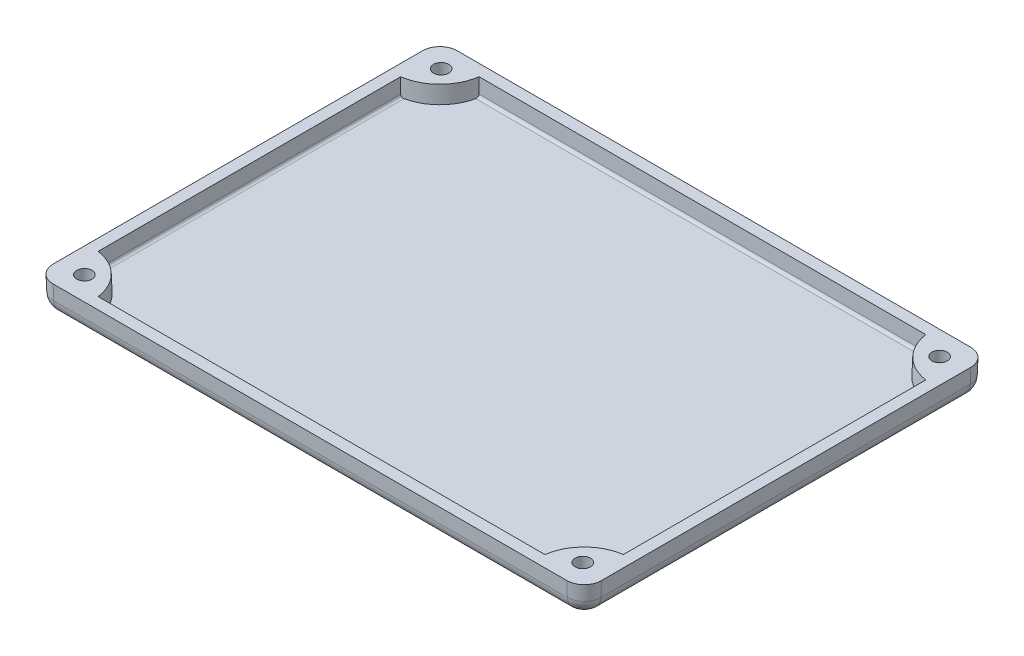
from build123d import *

# Parameters (mm, degrees)
BOSS_EXTRUDE1_MAINBOX_DEPTH             = 5
BOSS_EXTRUDE1_MAINBOX_TAPER             = 2
FILLET1_R                               = 2.5
SHELL1_T                                = -2
BOSS_EXTRUDE2_CORNERS_REACH             = 61.214
BOSS_EXTRUDE2_CORNERS_DRAFT             = 2
SKETCH3_R                               = 1.5
CUT_EXTRUDE1_SCREWHOLES_DEPTH           = 10
CUT_EXTRUDE1_SCREWHOLES_DRAFT           = -2
CUT_EXTRUDE1_SCREWHOLES_PROFILE_2_DEPTH = 10
CUT_EXTRUDE1_SCREWHOLES_PROFILE_2_DRAFT = -2
CUT_EXTRUDE1_SCREWHOLES_PROFILE_3_DEPTH = 10
CUT_EXTRUDE1_SCREWHOLES_PROFILE_3_DRAFT = -2
CUT_EXTRUDE1_SCREWHOLES_PROFILE_4_DEPTH = 10
CUT_EXTRUDE1_SCREWHOLES_PROFILE_4_DRAFT = -2


with BuildPart() as part:
    # Sketch1 → Boss-Extrude1-MainBox (new body)
    with BuildSketch(Plane(origin=(0, 0, 0), x_dir=(-1, 0, 0), z_dir=(0, -1, 0))):
        with BuildLine():
            add(Edge.make_bspline(
                [(47.5, -32.001827519), (47.5, -35), (44.501827519, -35)],
                knots=[5.498396131, 5.498396131, 5.498396131, 7.067974483, 7.067974483, 7.067974483], degree=2, weights=[1, 0.707537269, 1]))
            Line((47.5, -32.001827519), (47.5, 32.001827519))
            add(Edge.make_bspline(
                [(44.501827519, 35), (47.5, 35), (47.5, 32.001827519)],
                knots=[5.498396131, 5.498396131, 5.498396131, 7.067974483, 7.067974483, 7.067974483], degree=2, weights=[1, 0.707537269, 1]))
            Line((44.501827519, 35), (-44.501827519, 35))
            add(Edge.make_bspline(
                [(-47.5, 32.001827519), (-47.5, 35), (-44.501827519, 35)],
                knots=[5.498396131, 5.498396131, 5.498396131, 7.067974483, 7.067974483, 7.067974483], degree=2, weights=[1, 0.707537269, 1]))
            Line((-47.5, 32.001827519), (-47.5, -32.001827519))
            add(Edge.make_bspline(
                [(-44.501827519, -35), (-47.5, -35), (-47.5, -32.001827519)],
                knots=[5.498396131, 5.498396131, 5.498396131, 7.067974483, 7.067974483, 7.067974483], degree=2, weights=[1, 0.707537269, 1]))
            Line((-44.501827519, -35), (44.501827519, -35))
        make_face()
    extrude(amount=BOSS_EXTRUDE1_MAINBOX_DEPTH, taper=BOSS_EXTRUDE1_MAINBOX_TAPER)

    # Fillet1
    fillet1_edges = [part.edges().sort_by_distance(p)[0] for p in [
        (-47.110608428, -5, -33.082461748),
        (0, -5, -34.825396153),
        (45.582461748, -5, -34.610608428),
        (47.325396153, -5, 0),
        (47.110608428, -5, 33.082461748),
        (0, -5, 34.825396153),
        (-45.58246175, -5, 34.610608427),
        (-47.325396153, -5, 0),
    ]]
    fillet(fillet1_edges, radius=FILLET1_R)

    # Shell1
    shell1_openings = [part.faces().sort_by_distance(p)[0] for p in [
        (0, 0, 0),
    ]]
    offset(amount=SHELL1_T, openings=shell1_openings)




with BuildPart() as boss_extrude2_corners_long_prism_1:
    # Sketch2 → Boss-Extrude2-Corners (the long prism of profile 1, to be tilted and cut off)
    with BuildSketch(Plane(origin=(0, 0, 0), x_dir=(1, 0, 0), z_dir=(0, 1, 0))):
        with BuildLine():
            Line((-46.622077001, 26.122077001), (-46.622077001, 32.001827519))
            Line((-46.622077001, 32.001827519), (-44.501827519, 34.122077001))
            Line((-44.501827519, 34.122077001), (-38.622077001, 34.122077001))
            ThreePointArc((-38.622077001, 34.122077001), (-40.965222751, 28.465222751), (-46.622077001, 26.122077001))
        make_face()
    extrude(amount=-BOSS_EXTRUDE2_CORNERS_REACH)
    boss_extrude2_corners_tool1_sides = [boss_extrude2_corners_long_prism_1.faces().sort_by_distance(p)[0] for p in [
        (-40.965222751, -30.607, -28.465222751),
        (-46.622077001, -30.607, -29.06195226),
        (-45.56195226, -30.607, -33.06195226),
        (-41.56195226, -30.607, -34.122077001),
    ]]
    draft(boss_extrude2_corners_tool1_sides, Plane(origin=(0, 0, 0), x_dir=(1, 0, 0), z_dir=(0, 1, 0)), BOSS_EXTRUDE2_CORNERS_DRAFT)  # the draft: side faces tilted about the start plane


with BuildPart() as part_1:
    add(part.part)
    boss_extrude2_corners_tool1 = boss_extrude2_corners_long_prism_1.part - part.part



with BuildPart() as boss_extrude2_corners_long_prism_2:
    # Sketch2 → Boss-Extrude2-Corners (the long prism of profile 2, to be tilted and cut off)
    with BuildSketch(Plane(origin=(0, 0, 0), x_dir=(1, 0, 0), z_dir=(0, 1, 0))):
        with BuildLine():
            Line((44.501827519, 34.122077001), (38.622077001, 34.122077001))
            ThreePointArc((38.622077001, 34.122077001), (40.965222751, 28.465222751), (46.622077001, 26.122077001))
            Line((46.622077001, 26.122077001), (46.622077001, 32.001827519))
            Line((46.622077001, 32.001827519), (44.501827519, 34.122077001))
        make_face()
    extrude(amount=-BOSS_EXTRUDE2_CORNERS_REACH)
    boss_extrude2_corners_tool2_sides = [boss_extrude2_corners_long_prism_2.faces().sort_by_distance(p)[0] for p in [
        (41.56195226, -30.607, -34.122077001),
        (40.965222751, -30.607, -28.465222751),
        (46.622077001, -30.607, -29.06195226),
        (45.56195226, -30.607, -33.06195226),
    ]]
    draft(boss_extrude2_corners_tool2_sides, Plane(origin=(0, 0, 0), x_dir=(1, 0, 0), z_dir=(0, 1, 0)), BOSS_EXTRUDE2_CORNERS_DRAFT)  # the draft: side faces tilted about the start plane


with BuildPart() as part_2:
    add(part_1.part)
    boss_extrude2_corners_tool2 = boss_extrude2_corners_long_prism_2.part - part.part



with BuildPart() as boss_extrude2_corners_long_prism_3:
    # Sketch2 → Boss-Extrude2-Corners (the long prism of profile 3, to be tilted and cut off)
    with BuildSketch(Plane(origin=(0, 0, 0), x_dir=(1, 0, 0), z_dir=(0, 1, 0))):
        with BuildLine():
            Line((46.622077001, -26.122077001), (46.622077001, -32.001827519))
            Line((46.622077001, -32.001827519), (44.501827519, -34.122077001))
            Line((44.501827519, -34.122077001), (38.622077001, -34.122077001))
            ThreePointArc((38.622077001, -34.122077001), (40.965222751, -28.465222751), (46.622077001, -26.122077001))
        make_face()
    extrude(amount=-BOSS_EXTRUDE2_CORNERS_REACH)
    boss_extrude2_corners_tool3_sides = [boss_extrude2_corners_long_prism_3.faces().sort_by_distance(p)[0] for p in [
        (46.622077001, -30.607, 29.06195226),
        (45.56195226, -30.607, 33.06195226),
        (41.56195226, -30.607, 34.122077001),
        (40.965222751, -30.607, 28.465222751),
    ]]
    draft(boss_extrude2_corners_tool3_sides, Plane(origin=(0, 0, 0), x_dir=(1, 0, 0), z_dir=(0, 1, 0)), BOSS_EXTRUDE2_CORNERS_DRAFT)  # the draft: side faces tilted about the start plane


with BuildPart() as part_3:
    add(part_2.part)
    boss_extrude2_corners_tool3 = boss_extrude2_corners_long_prism_3.part - part.part



with BuildPart() as boss_extrude2_corners_long_prism_4:
    # Sketch2 → Boss-Extrude2-Corners (the long prism of profile 4, to be tilted and cut off)
    with BuildSketch(Plane(origin=(0, 0, 0), x_dir=(1, 0, 0), z_dir=(0, 1, 0))):
        with BuildLine():
            Line((-44.501827519, -34.122077001), (-38.622077001, -34.122077001))
            ThreePointArc((-38.622077001, -34.122077001), (-40.965222751, -28.465222751), (-46.622077001, -26.122077001))
            Line((-46.622077001, -26.122077001), (-46.622077001, -32.001827519))
            Line((-46.622077001, -32.001827519), (-44.501827519, -34.122077001))
        make_face()
    extrude(amount=-BOSS_EXTRUDE2_CORNERS_REACH)
    boss_extrude2_corners_tool4_sides = [boss_extrude2_corners_long_prism_4.faces().sort_by_distance(p)[0] for p in [
        (-40.965222751, -30.607, 28.465222751),
        (-46.622077001, -30.607, 29.06195226),
        (-45.56195226, -30.607, 33.06195226),
        (-41.56195226, -30.607, 34.122077001),
    ]]
    draft(boss_extrude2_corners_tool4_sides, Plane(origin=(0, 0, 0), x_dir=(1, 0, 0), z_dir=(0, 1, 0)), BOSS_EXTRUDE2_CORNERS_DRAFT)  # the draft: side faces tilted about the start plane


with BuildPart() as part_4:
    add(part_3.part)
    boss_extrude2_corners_tool4 = boss_extrude2_corners_long_prism_4.part - part.part
    add(boss_extrude2_corners_tool1.solids().sort_by_distance((-43.100919, 0, -30.600919))[0])
    add(boss_extrude2_corners_tool2.solids().sort_by_distance((43.100919, 0, -30.600919))[0])
    add(boss_extrude2_corners_tool3.solids().sort_by_distance((43.100919, 0, 30.600919))[0])
    add(boss_extrude2_corners_tool4.solids().sort_by_distance((-43.100919, 0, 30.600919))[0])


with BuildPart() as cut_extrude1_screwholes_tool:
    # Sketch3 → Cut-Extrude1-ScrewHoles (with draft: the straight prism first)
    with BuildSketch(Plane.XZ.offset(5)):
        with Locations((-43.180680713, 30.909651283)):
            Circle(SKETCH3_R)
    extrude(amount=-CUT_EXTRUDE1_SCREWHOLES_DEPTH)
    # Cut-Extrude1-ScrewHoles: the draft: its side faces are tilted about the plane it starts from
    cut_extrude1_screwholes_sides = [cut_extrude1_screwholes_tool.faces().sort_by_distance(p)[0] for p in [
        (-44.680680713, 0, 30.909651283),
    ]]
    draft(cut_extrude1_screwholes_sides, Plane.XZ.offset(5), CUT_EXTRUDE1_SCREWHOLES_DRAFT)


with BuildPart() as part_5:
    add(part_4.part)

    # Cut-Extrude1-ScrewHoles: cut by cut_extrude1_screwholes_tool
    add(cut_extrude1_screwholes_tool.part, mode=Mode.SUBTRACT)


with BuildPart() as cut_extrude1_screwholes_profile_2_tool:
    # Sketch3 → Cut-Extrude1-ScrewHoles profile 2 (with draft: the straight prism first)
    with BuildSketch(Plane.XZ.offset(5)):
        with Locations((43.180680713, 30.909651283)):
            Circle(SKETCH3_R)
    extrude(amount=-CUT_EXTRUDE1_SCREWHOLES_PROFILE_2_DEPTH)
    # Cut-Extrude1-ScrewHoles profile 2: the draft: its side faces are tilted about the plane it starts from
    cut_extrude1_screwholes_profile_2_sides = [cut_extrude1_screwholes_profile_2_tool.faces().sort_by_distance(p)[0] for p in [
        (41.680680713, 0, 30.909651283),
    ]]
    draft(cut_extrude1_screwholes_profile_2_sides, Plane.XZ.offset(5), CUT_EXTRUDE1_SCREWHOLES_PROFILE_2_DRAFT)


with BuildPart() as part_6:
    add(part_5.part)

    # Cut-Extrude1-ScrewHoles profile 2: cut by cut_extrude1_screwholes_profile_2_tool
    add(cut_extrude1_screwholes_profile_2_tool.part, mode=Mode.SUBTRACT)


with BuildPart() as cut_extrude1_screwholes_profile_3_tool:
    # Sketch3 → Cut-Extrude1-ScrewHoles profile 3 (with draft: the straight prism first)
    with BuildSketch(Plane.XZ.offset(5)):
        with Locations((43.180680713, -30.909651283)):
            Circle(SKETCH3_R)
    extrude(amount=-CUT_EXTRUDE1_SCREWHOLES_PROFILE_3_DEPTH)
    # Cut-Extrude1-ScrewHoles profile 3: the draft: its side faces are tilted about the plane it starts from
    cut_extrude1_screwholes_profile_3_sides = [cut_extrude1_screwholes_profile_3_tool.faces().sort_by_distance(p)[0] for p in [
        (41.680680713, 0, -30.909651283),
    ]]
    draft(cut_extrude1_screwholes_profile_3_sides, Plane.XZ.offset(5), CUT_EXTRUDE1_SCREWHOLES_PROFILE_3_DRAFT)


with BuildPart() as part_7:
    add(part_6.part)

    # Cut-Extrude1-ScrewHoles profile 3: cut by cut_extrude1_screwholes_profile_3_tool
    add(cut_extrude1_screwholes_profile_3_tool.part, mode=Mode.SUBTRACT)


with BuildPart() as cut_extrude1_screwholes_profile_4_tool:
    # Sketch3 → Cut-Extrude1-ScrewHoles profile 4 (with draft: the straight prism first)
    with BuildSketch(Plane.XZ.offset(5)):
        with Locations((-43.180680713, -30.909651283)):
            Circle(SKETCH3_R)
    extrude(amount=-CUT_EXTRUDE1_SCREWHOLES_PROFILE_4_DEPTH)
    # Cut-Extrude1-ScrewHoles profile 4: the draft: its side faces are tilted about the plane it starts from
    cut_extrude1_screwholes_profile_4_sides = [cut_extrude1_screwholes_profile_4_tool.faces().sort_by_distance(p)[0] for p in [
        (-44.680680713, 0, -30.909651283),
    ]]
    draft(cut_extrude1_screwholes_profile_4_sides, Plane.XZ.offset(5), CUT_EXTRUDE1_SCREWHOLES_PROFILE_4_DRAFT)


with BuildPart() as part_8:
    add(part_7.part)

    # Cut-Extrude1-ScrewHoles profile 4: cut by cut_extrude1_screwholes_profile_4_tool
    add(cut_extrude1_screwholes_profile_4_tool.part, mode=Mode.SUBTRACT)


solid = part_8.part
